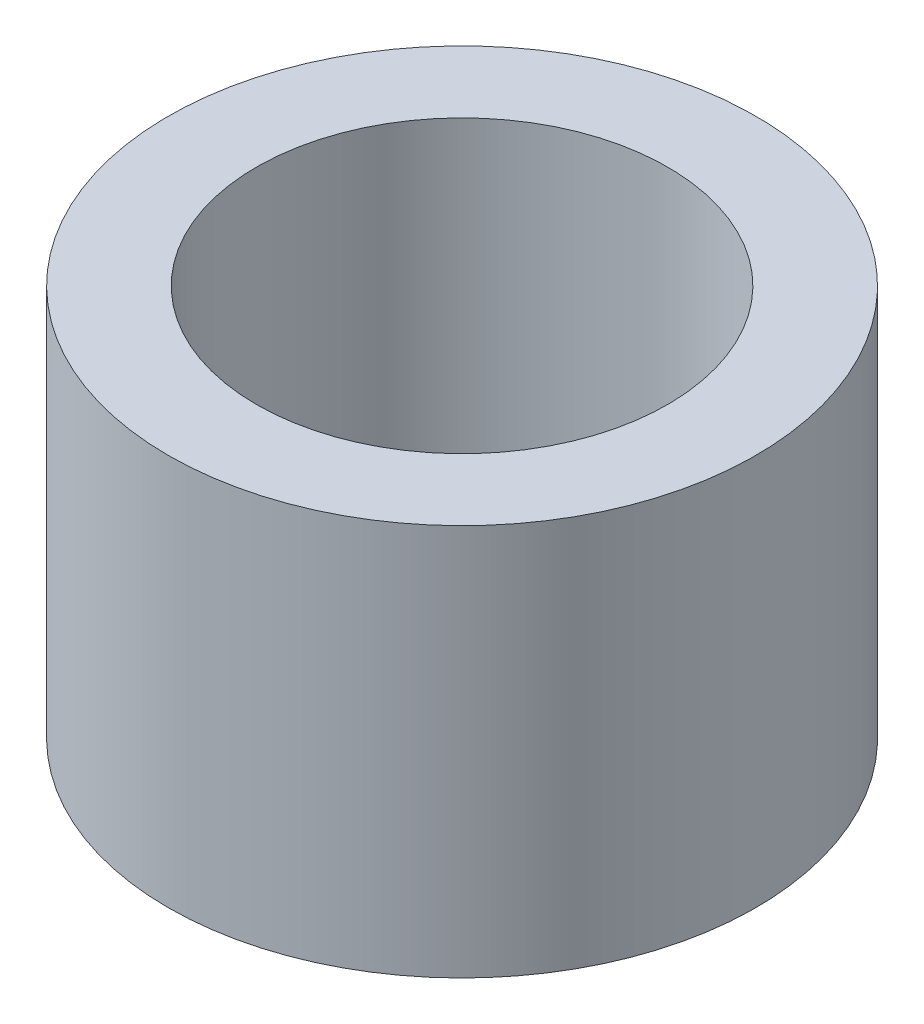
from build123d import *

# Parameters (mm, degrees)
SKETCH_1_R      = 3
SKETCH_1_R_2    = 2.1
EXTRUDE_1_DEPTH = 4


with BuildPart() as part:
    # ｽｹｯﾁ1 → ﾎﾞｽ - 押し出し1 (new body)
    with BuildSketch(Plane(origin=(0, 0, 0), x_dir=(1, 0, 0), z_dir=(0, 1, 0))):
        with Locations(Location((0, 0, 0), (0, 0, 270))):
            Circle(SKETCH_1_R)
        with Locations(Location((0, 0, 0), (0, 0, 270))):
            Circle(SKETCH_1_R_2, mode=Mode.SUBTRACT)
    extrude(amount=EXTRUDE_1_DEPTH)


solid = part.part
